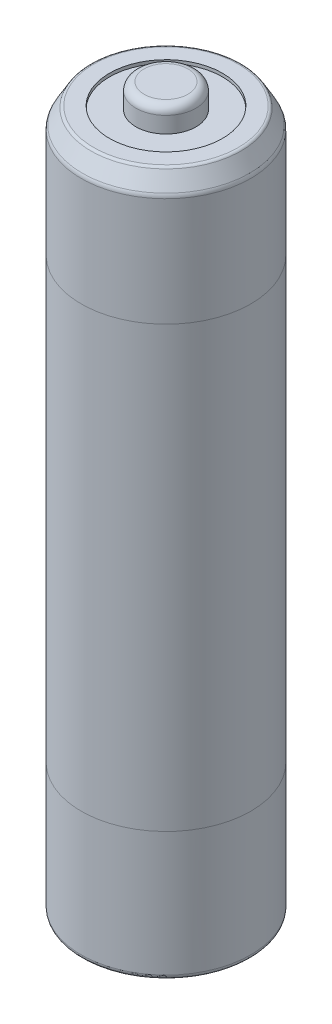
from build123d import *


with BuildPart() as part:
    # Esquisse1 → Révolution1 (revolve)
    with BuildSketch(Plane.XY):
        with BuildLine():
            Line((-1.36, 44.5), (0, 44.5))
            Line((0, 44.5), (0, 0))
            Line((0, 0), (-4.95, 0))
            ThreePointArc((-4.95, 0), (-5.162132034, 0.087867966), (-5.25, 0.3))
            Line((-5.25, 0.3), (-5.25, 41.926794919))
            ThreePointArc((-5.25, 41.926794919), (-5.232962913, 42.056204442), (-5.183012702, 42.176794919))
            Line((-5.183012702, 42.176794919), (-4.65, 43.1))
            ThreePointArc((-4.65, 43.1), (-4.576794919, 43.173205081), (-4.476794919, 43.2))
            Line((-4.476794919, 43.2), (-3.5, 43.2))
            Line((-3.5, 43.2), (-3.5, 43))
            Line((-3.5, 43), (-1.86, 43))
            Line((-1.86, 43), (-1.86, 44))
            ThreePointArc((-1.86, 44), (-1.713553391, 44.353553391), (-1.36, 44.5))
        make_face()
    revolve(axis=Axis((0, 0, 0), (0, 1, 0)))


solid = part.part
